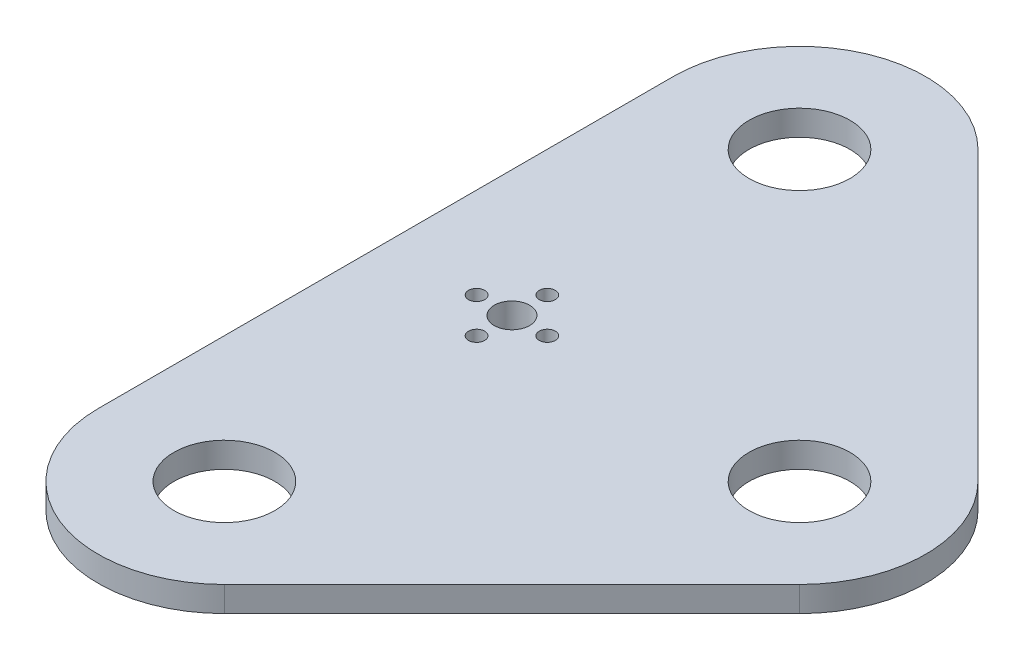
from build123d import *

# Parameters (mm, degrees)
SKETCH_1_R      = 1.6
SKETCH_1_R_2    = 3.5
SKETCH_1_R_3    = 25
SKETCH_1_R_4    = 10
EXTRUDE_1_DEPTH = 5


with BuildPart() as part:
    # 草图1 → 凸台-拉伸1 (new body)
    # profile 1 of 4: a face of its own
    with BuildSketch(Plane(origin=(0, 0, 0), x_dir=(1, 0, 0), z_dir=(0, 1, 0))):
        with BuildLine():
            ThreePointArc((25, 56.96), (0, 31.96), (-25, 56.96))
            Line((-25, 56.96), (-25, -56.96))
            ThreePointArc((-25, -56.96), (0, -31.96), (25, -56.96))
            ThreePointArc((25, -56.96), (23.096988313, -66.527085809), (17.67766953, -74.63766953))
            Line((17.67766953, -74.63766953), (74.63766953, -17.67766953))
            ThreePointArc((74.63766953, -17.67766953), (31.96, 0), (74.63766953, 17.67766953))
            Line((74.63766953, 17.67766953), (17.67766953, 74.63766953))
            ThreePointArc((17.67766953, 74.63766953), (23.096988313, 66.527085809), (25, 56.96))
        make_face()
        with Locations(Location((0, -7, 0), (0, 0, 270))):
            Circle(SKETCH_1_R, mode=Mode.SUBTRACT)
        with Locations(Location((-7, 0, 0), (0, 0, 270))):
            Circle(SKETCH_1_R, mode=Mode.SUBTRACT)
        with Locations(Location((0, 0, 0), (0, 0, 270))):
            Circle(SKETCH_1_R_2, mode=Mode.SUBTRACT)
        with Locations(Location((0, 7, 0), (0, 0, 270))):
            Circle(SKETCH_1_R, mode=Mode.SUBTRACT)
        with Locations(Location((7, 0, 0), (0, 0, 270))):
            Circle(SKETCH_1_R, mode=Mode.SUBTRACT)
    # profile 2 of 4: a face of its own
    with BuildSketch(Plane(origin=(0, 0, 0), x_dir=(1, 0, 0), z_dir=(0, 1, 0))):
        with Locations((0, -56.96)):
            Circle(SKETCH_1_R_3)
        with Locations(Location((0, -56.96, 0), (0, 0, 270))):
            Circle(SKETCH_1_R_4, mode=Mode.SUBTRACT)
    # profile 3 of 4: a face of its own
    with BuildSketch(Plane(origin=(0, 0, 0), x_dir=(1, 0, 0), z_dir=(0, 1, 0))):
        with Locations((56.96, 0)):
            Circle(SKETCH_1_R_3)
        with Locations(Location((56.96, 0, 0), (0, 0, 270))):
            Circle(SKETCH_1_R_4, mode=Mode.SUBTRACT)
    # profile 4 of 4: a face of its own
    with BuildSketch(Plane(origin=(0, 0, 0), x_dir=(1, 0, 0), z_dir=(0, 1, 0))):
        with Locations((0, 56.96)):
            Circle(SKETCH_1_R_3)
        with Locations(Location((0, 56.96, 0), (0, 0, 270))):
            Circle(SKETCH_1_R_4, mode=Mode.SUBTRACT)
    extrude(amount=EXTRUDE_1_DEPTH)


solid = part.part
